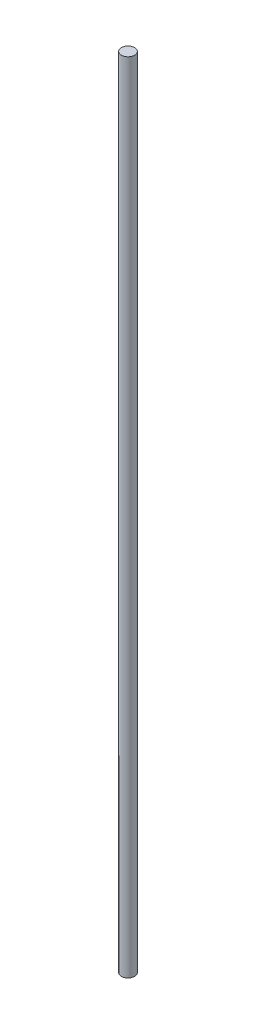
from build123d import *

# Parameters (mm, degrees)
SKETCH1_R           = 1.5
BOSS_EXTRUDE1_DEPTH = 87.5
BOSS_EXTRUDE2_START = 6
SKETCH2_R           = 1.5
BOSS_EXTRUDE2_DEPTH = 6


with BuildPart() as part:
    # Sketch1 → Boss-Extrude1 (new, symmetric)
    with BuildSketch(Plane(origin=(0, 0, 0), x_dir=(1, 0, 0), z_dir=(0, 1, 0))):
        with Locations(Location((0, 0, 0), (0, 0, 270))):
            Circle(SKETCH1_R)
    extrude(amount=BOSS_EXTRUDE1_DEPTH, both=True)

    # Sketch2 → Boss-Extrude2 (add)
    with BuildSketch(Plane(origin=(0, 87.5, 0), x_dir=(1, 0, 0), z_dir=(0, 1, 0)).offset(BOSS_EXTRUDE2_START)):
        with Locations(Location((0, 0, 0), (0, 0, 270))):
            Circle(SKETCH2_R)
    extrude(amount=-BOSS_EXTRUDE2_DEPTH)


solid = part.part
